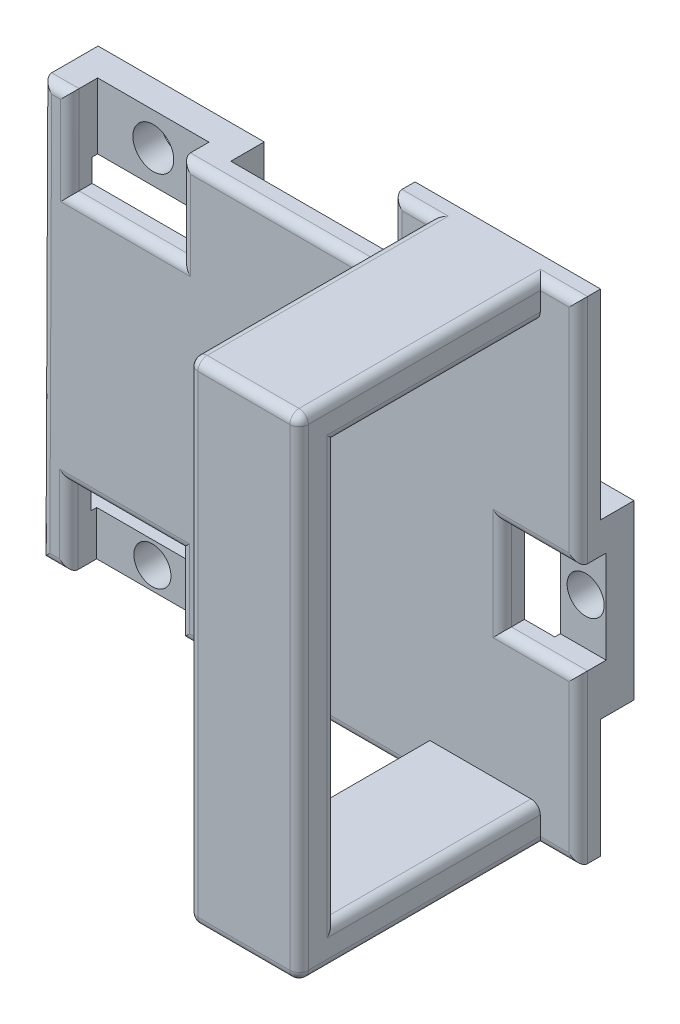
from build123d import *

# Parameters (mm, degrees)
SZKIC1_W                      = 9.053278123
SZKIC1_H                      = 2.4000014
SZKIC1_R                      = 1.00000054
DODANIE_WYCI_GNI_CIE1_DEPTH   = 1.8
SZKIC1_W_2                    = 2.468942166
SZKIC1_H_2                    = 9.307035938
DODANIE_WYCI_GNI_CIE1_2_DEPTH = 1.8
SZKIC1_W_3                    = 8.953699963
SZKIC1_H_3                    = 3.54899108
SZKIC1_R_2                    = 1.10000034
DODANIE_WYCI_GNI_CIE1_3_DEPTH = 1.8
SZKIC2_R                      = 1.00000054
SZKIC2_R_2                    = 1.10000034
DODANIE_WYCI_GNI_CIE2_DEPTH   = 1.2
WYTNIJ_WYCI_GNI_CIE1_START    = -1.5
SZKIC3_W                      = 4.104918972
SZKIC3_H                      = 5
SZKIC3_R                      = 1.00000054
SZKIC3_W_2                    = 6
SZKIC3_H_2                    = 4.77449554
SZKIC3_R_2                    = 1.10000034
SZKIC3_H_3                    = 4.2000007
WYTNIJ_WYCI_GNI_CIE1_DEPTH    = 1.5
SZKIC7_W                      = 10
SZKIC7_H                      = 1.2
DODANIE_WYCI_GNI_CIE3_DEPTH   = 4
SZKIC8_W                      = 5.950377167
SZKIC8_H                      = 2
DODANIE_WYCI_GNI_CIE4_DEPTH   = 11
SZKIC9_W                      = 5.950377167
SZKIC9_H                      = 26.47425658
DODANIE_WYCI_GNI_CIE5_DEPTH   = 2
ZAOKR_GLENIE4_R               = 0.5


with BuildPart() as part:
    # Szkic1 → Dodanie-wyciągnięcie1 (new body)
    with BuildSketch(Plane.XY.offset(158.832884642)):
        with Locations((-14.973320297, -21.27425588)):
            Rectangle(SZKIC1_W, SZKIC1_H)
        with Locations((-14.973320296, -21.27425588)):
            Circle(SZKIC1_R, mode=Mode.SUBTRACT)
    extrude(amount=DODANIE_WYCI_GNI_CIE1_DEPTH)



with BuildPart() as body_2:
    # Szkic1 → Dodanie-wyci_gni_cie1 2 (new body)
    with BuildSketch(Plane.XY.offset(158.832884642)):
        with Locations((8.247126613, -11.430282713)):
            Rectangle(SZKIC1_W_2, SZKIC1_H_2)
        with Locations((8.376678724, -10.97425616)):
            Circle(SZKIC1_R, mode=Mode.SUBTRACT)
    extrude(amount=DODANIE_WYCI_GNI_CIE1_2_DEPTH)


with BuildPart() as body_3:
    # Szkic1 → Dodanie-wyci_gni_cie1 3 (new body)
    with BuildSketch(Plane.XY.offset(158.832884642)):
        with Locations((-14.923531217, -1.77449554)):
            Rectangle(SZKIC1_W_3, SZKIC1_H_3)
        with Locations((-14.923531216, -1.77449554)):
            Circle(SZKIC1_R_2, mode=Mode.SUBTRACT)
    extrude(amount=DODANIE_WYCI_GNI_CIE1_3_DEPTH)


with BuildPart() as part_1:
    add(part.part)

    add(body_2.part)  # Dodanie-wyciągnięcie2 merges body 2

    add(body_3.part)  # Dodanie-wyciągnięcie2 merges body 3
    # Szkic2 → Dodanie-wyciągnięcie2 (add)
    with BuildSketch(Plane.XY.offset(160.632884642)):
        Polygon((9.481597696, 0), (-19.400381198, 0), (-19.499959358, -22.47425658), (9.481597696, -22.47425658), align=None)
        with Locations((8.376678724, -10.97425616)):
            Circle(SZKIC2_R, mode=Mode.SUBTRACT)
        with Locations((-14.973320296, -21.27425588)):
            Circle(SZKIC2_R, mode=Mode.SUBTRACT)
        with Locations((-14.923531216, -1.77449554)):
            Circle(SZKIC2_R_2, mode=Mode.SUBTRACT)
    extrude(amount=DODANIE_WYCI_GNI_CIE2_DEPTH)

    # Szkic3 → Wytnij-wyciągnięcie1 (cut)
    # profile 1 of 3: a face of its own
    with BuildSketch(Plane.XY.offset(161.832884642).offset(WYTNIJ_WYCI_GNI_CIE1_START)):
        with Locations((7.42913821, -10.97425616)):
            Rectangle(SZKIC3_W, SZKIC3_H)
        with Locations((8.376678724, -10.97425616)):
            Circle(SZKIC3_R, mode=Mode.SUBTRACT)
    # profile 2 of 3: a face of its own
    with BuildSketch(Plane.XY.offset(161.832884642).offset(WYTNIJ_WYCI_GNI_CIE1_START)):
        with Locations((-14.923531216, -2.38724777)):
            Rectangle(SZKIC3_W_2, SZKIC3_H_2)
        with Locations((-14.923531216, -1.77449554)):
            Circle(SZKIC3_R_2, mode=Mode.SUBTRACT)
    # profile 3 of 3: a face of its own
    with BuildSketch(Plane.XY.offset(161.832884642).offset(WYTNIJ_WYCI_GNI_CIE1_START)):
        with Locations((-14.973320296, -20.37425623)):
            Rectangle(SZKIC3_W_2, SZKIC3_H_3)
        with Locations((-14.973320296, -21.27425588)):
            Circle(SZKIC3_R, mode=Mode.SUBTRACT)
    extrude(amount=WYTNIJ_WYCI_GNI_CIE1_DEPTH, mode=Mode.SUBTRACT)

    # Szkic7 → Dodanie-wyciągnięcie3 (add)
    with BuildSketch(Plane(origin=(0, 0, 0), x_dir=(1, 0, 0), z_dir=(0, 1, 0))):
        with Locations((4.481597696, -161.232884642)):
            Rectangle(SZKIC7_W, SZKIC7_H)
    extrude(amount=DODANIE_WYCI_GNI_CIE3_DEPTH)

    # Szkic8 → Dodanie-wyciągnięcie4 (add)
    with BuildSketch(Plane.XY.offset(161.832884642)):
        with Locations((4.45678628, 3)):
            Rectangle(SZKIC8_W, SZKIC8_H)
        with Locations((4.45678628, -21.47425658)):
            Rectangle(SZKIC8_W, SZKIC8_H)
    extrude(amount=DODANIE_WYCI_GNI_CIE4_DEPTH)

    # Szkic9 → Dodanie-wyciągnięcie5 (add)
    with BuildSketch(Plane.XY.offset(172.832884642)):
        with Locations((4.45678628, -9.23712829)):
            Rectangle(SZKIC9_W, SZKIC9_H)
    extrude(amount=DODANIE_WYCI_GNI_CIE5_DEPTH)

    # Zaokrąglenie4
    zaokr_glenie4_edges = [part_1.edges().sort_by_distance(p)[0] for p in [
        (-11.973320296, -20.37425623, 161.832884642),
        (-14.973320296, -18.27425588, 161.832884642),
        (-17.973320296, -20.37425623, 161.832884642),
        (-6.22096676, 0, 161.832884642),
        (-0.518402304, 2, 161.832884642),
        (0.481597696, 4, 161.832884642),
        (8.456786279, 4, 161.832884642),
        (7.431974863, 2, 167.332884642),
        (7.431974863, 4, 168.332884642),
        (1.481597696, 4, 168.332884642),
        (1.481597696, 2, 167.332884642),
        (8.456786279, -22.47425658, 161.832884642),
        (7.431974863, -22.47425658, 168.332884642),
        (7.431974863, -20.47425658, 167.332884642),
        (1.481597696, -22.47425658, 168.332884642),
        (7.431974863, -9.23712829, 172.832884642),
        (1.481597696, -9.23712829, 172.832884642),
        (7.431974863, -9.23712829, 174.832884642),
        (4.456786279, 4, 174.832884642),
        (1.481597696, -9.23712829, 174.832884642),
        (4.456786279, -22.47425658, 174.832884642),
        (9.481597696, -17.97425637, 161.832884642),
        (-19.450170278, -11.23712829, 161.832884642),
        (-18.736639827, -22.47425658, 161.832884642),
        (-18.661956207, 0, 161.832884642),
        (9.481597696, -2.23712808, 161.832884642),
        (-5.2458613, -22.47425658, 161.832884642),
        (7.42913821, -8.47425616, 161.832884642),
        (5.376678724, -10.97425616, 161.832884642),
        (7.42913821, -13.47425616, 161.832884642),
        (-17.923531216, -2.38724777, 161.832884642),
        (-14.923531216, -4.77449554, 161.832884642),
        (-11.923531216, -2.38724777, 161.832884642),
    ]]
    fillet(zaokr_glenie4_edges, radius=ZAOKR_GLENIE4_R)


solid = part_1.part
